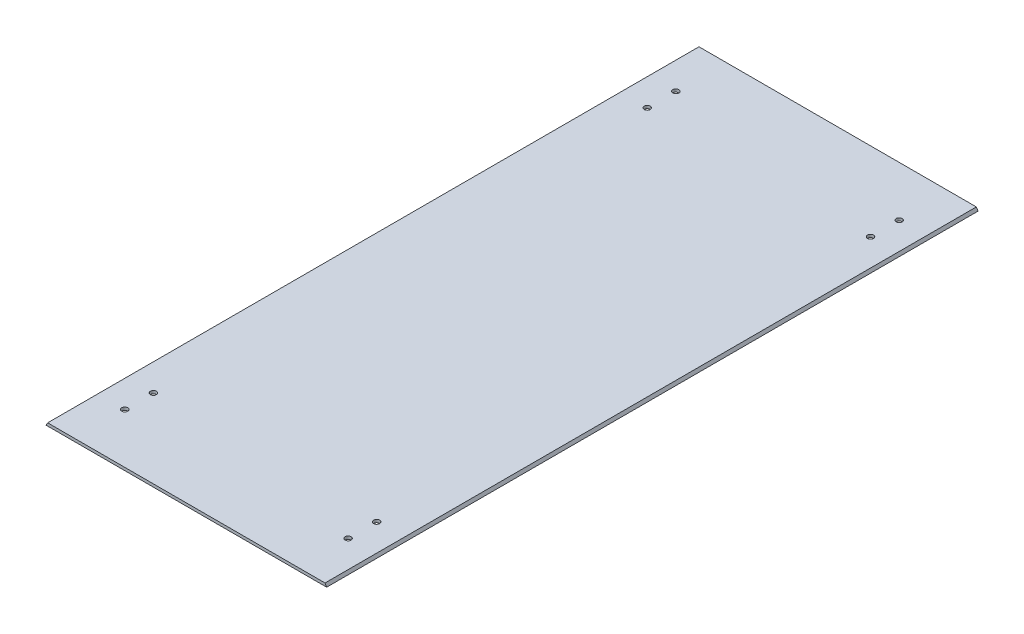
from build123d import *

# Parameters (mm, degrees)
EXTRUDE_1_DEPTH     = 455
SKETCH_3_R          = 2.1
CUT_EXTRUDE_1_DEPTH = 466.453246739


with BuildPart() as part:
    # 草图2 → 凸台-拉伸1 (new body)
    with BuildSketch(Plane.XY):
        Polygon((-98, -1), (-96.845299462, 1), (96.915299462, 1), (98.07, -1), align=None)
    extrude(amount=-EXTRUDE_1_DEPTH)

    # 草图3 → 切除-拉伸1 (cut, through all)
    with BuildSketch(Plane(origin=(0, -1, 0), x_dir=(-1, 0, 0), z_dir=(0, -1, 0))):
        with Locations(Location((78, 35, 0), (0, 0, 90))):
            Circle(SKETCH_3_R)
        with Locations(Location((78, 55, 0), (0, 0, 90))):
            Circle(SKETCH_3_R)
        with Locations(Location((-78, 55, 0), (0, 0, 270))):
            Circle(SKETCH_3_R)
        with Locations(Location((-78, 35, 0), (0, 0, 270))):
            Circle(SKETCH_3_R)
        with Locations(Location((-78, 420, 0), (0, 0, 90))):
            Circle(SKETCH_3_R)
        with Locations(Location((-78, 400, 0), (0, 0, 90))):
            Circle(SKETCH_3_R)
        with Locations(Location((78, 400, 0), (0, 0, 270))):
            Circle(SKETCH_3_R)
        with Locations(Location((78, 420, 0), (0, 0, 270))):
            Circle(SKETCH_3_R)
    extrude(amount=-CUT_EXTRUDE_1_DEPTH, mode=Mode.SUBTRACT)


solid = part.part
